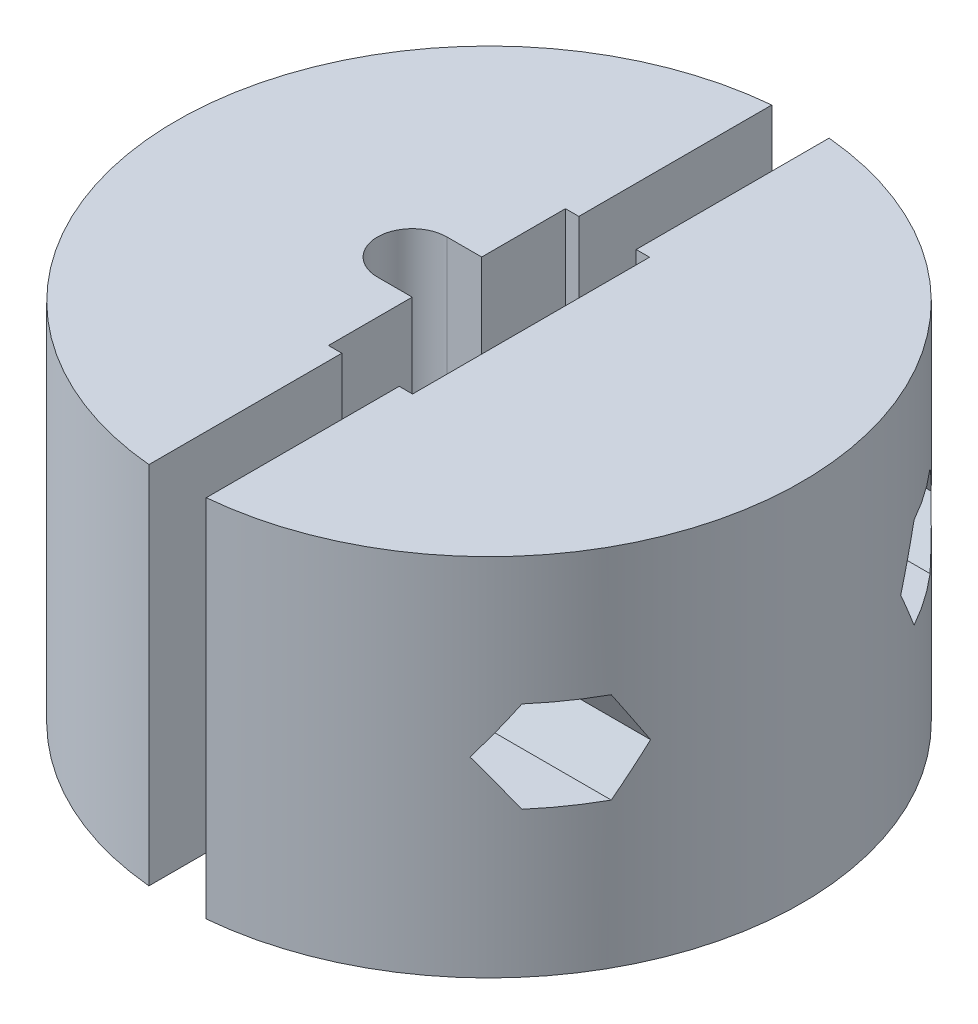
from build123d import *

# Parameters (mm, degrees)
SKETCH1_R               = 18
BOSS_EXTRUDE1_DEPTH     = 21
CUT_EXTRUDE1_DEPTH      = 34
CUT_EXTRUDE1_DEPTH_BACK = 34
CUT_EXTRUDE2_DEPTH      = 46.398237851
CUT_EXTRUDE2_DEPTH_BACK = 46.398237851
SKETCH7_R               = 1.5
SKETCH8_R               = 2.5
CUT_EXTRUDE3_DEPTH      = 11
CUT_EXTRUDE4_DEPTH      = 11
CUT_EXTRUDE7_DEPTH      = 34.000000173


with BuildPart() as part:
    # Sketch1 → Boss-Extrude1 (new body)
    with BuildSketch(Plane(origin=(0, 0, 0), x_dir=(1, 0, 0), z_dir=(0, 1, 0))):
        with Locations(Location((0, 0, 0), (0, 0, 90))):
            Circle(SKETCH1_R)
    extrude(amount=BOSS_EXTRUDE1_DEPTH)

    # Sketch5 → Cut-Revolve2 (revolve, cut)
    with BuildSketch(Plane(origin=(0, 0, 0), x_dir=(-1, 0, 0), z_dir=(0, -1, 0))):
        with BuildLine():
            Line((-12, -2.25), (-12, 2.25))
            ThreePointArc((-12, 2.25), (-9.75, 0), (-12, -2.25))
        make_face()
    revolve(axis=Axis((12, 0, 2.25), (0, 0, -1)), mode=Mode.SUBTRACT)

    # Sketch6 → Cut-Extrude1 (cut, two sides: drawn at the far end of the back side and taken through both)
    with BuildSketch(Plane(origin=(0, 21, 0), x_dir=(1, 0, 0), z_dir=(0, 1, 0)).offset(-CUT_EXTRUDE1_DEPTH_BACK)):
        with BuildLine():
            Line((-4.42, 2), (-2.42, 2))
            Line((-2.42, 2), (-2.42, 6.82))
            Line((-2.42, 6.82), (2.42, 6.82))
            Line((2.42, 6.82), (2.42, -6.82))
            Line((2.42, -6.82), (-2.42, -6.82))
            Line((-2.42, -6.82), (-2.42, -2))
            Line((-2.42, -2), (-4.42, -2))
            ThreePointArc((-4.42, -2), (-6.42, 0), (-4.42, 2))
        make_face()
    extrude(amount=CUT_EXTRUDE1_DEPTH + CUT_EXTRUDE1_DEPTH_BACK, mode=Mode.SUBTRACT)

    # Sketch7 → Cut-Extrude2 (cut, two sides: drawn at the far end of the back side and taken through both)
    with BuildSketch(Plane.ZY.offset(18).offset(-CUT_EXTRUDE2_DEPTH_BACK)):
        with Locations((-10.23, 11)):
            Circle(SKETCH7_R)
        with Locations((10.23, 11)):
            Circle(SKETCH7_R)
    extrude(amount=CUT_EXTRUDE2_DEPTH + CUT_EXTRUDE2_DEPTH_BACK, mode=Mode.SUBTRACT)

    # Sketch8 → Cut-Extrude3 (cut)
    with BuildSketch(Plane.ZY.offset(18)):
        with Locations((-10.23, 11)):
            Circle(SKETCH8_R)
        with Locations((10.23, 11)):
            Circle(SKETCH8_R)
    extrude(amount=-CUT_EXTRUDE3_DEPTH, mode=Mode.SUBTRACT)

    # Sketch9 → Cut-Extrude4 (cut)
    with BuildSketch(Plane(origin=(18, 0, 0), x_dir=(0, 0, -1), z_dir=(1, 0, 0))):
        Polygon((-8.714455543, 13.625), (-11.745544457, 13.625), (-13.261088913, 11), (-11.745544457, 8.375), (-8.714455543, 8.375), (-7.198911087, 11), align=None)
        Polygon((11.745544457, 13.625), (8.714455543, 13.625), (7.198911087, 11), (8.714455543, 8.375), (11.745544457, 8.375), (13.261088913, 11), align=None)
    extrude(amount=-CUT_EXTRUDE4_DEPTH, mode=Mode.SUBTRACT)

    # Sketch14 → Cut-Extrude7 (cut, through all)
    with BuildSketch(Plane(origin=(0, 21, 0), x_dir=(1, 0, 0), z_dir=(0, 1, 0))):
        with BuildLine():
            ThreePointArc((1.65, 17.924215464), (0.825869738, 17.981043884), (0, 18))
            ThreePointArc((0, 18), (-0.825869738, 17.981043884), (-1.65, 17.924215464))
            Line((-1.65, 17.924215464), (-1.65, 6.82))
            Line((-1.65, 6.82), (1.65, 6.82))
            Line((1.65, 6.82), (1.65, 17.924215464))
        make_face()
        with BuildLine():
            Line((-1.65, -6.82), (-1.65, -17.924215464))
            ThreePointArc((-1.65, -17.924215464), (-0.825869738, -17.981043884), (0, -18))
            ThreePointArc((0, -18), (0.825869738, -17.981043884), (1.65, -17.924215464))
            Line((1.65, -17.924215464), (1.65, -6.82))
            Line((1.65, -6.82), (-1.65, -6.82))
        make_face()
    extrude(amount=-CUT_EXTRUDE7_DEPTH, mode=Mode.SUBTRACT)


with BuildPart() as cut_extrude7_piece_1:
    # of the separate pieces the step leaves, piece 1, a body of its own (cut_extrude7_pieces)
    add(part.part.solids().sort_by_distance((1.65, 21, -17.924215464))[0])


with BuildPart() as cut_extrude7_piece_2:
    # of the separate pieces the step leaves, piece 2, a body of its own (cut_extrude7_pieces)
    add(part.part.solids().sort_by_distance((-1.65, 0, -17.924215464))[0])


solid = Compound([cut_extrude7_piece_1.part, cut_extrude7_piece_2.part])
